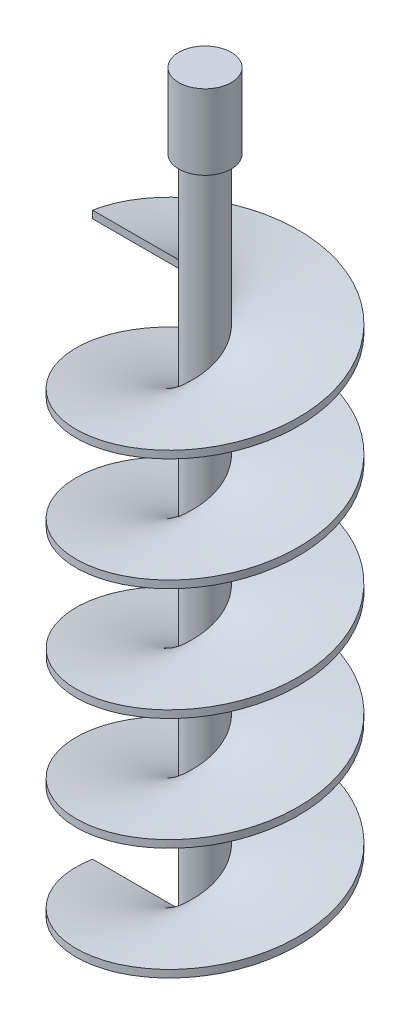
from build123d import *
from build123d.topology import SkipClean

# Parameters (mm, degrees)
SKETCH1_R           = 5
BOSS_EXTRUDE1_DEPTH = 200
SWEEP1_PITCH        = 30
SWEEP1_HEIGHT       = 150
SWEEP1_RADIUS       = 5
SWEEP1_START_ANGLE  = -90
SKETCH5_R           = 7
BOSS_EXTRUDE2_DEPTH = 20


with BuildPart() as part:
    # Sketch1 → Boss-Extrude1 (new body)
    with BuildSketch(Plane(origin=(0, 0, 0), x_dir=(1, 0, 0), z_dir=(0, 1, 0))):
        with Locations(Location((0, 0, 0), (0, 0, 270))):
            Circle(SKETCH1_R)
    extrude(amount=BOSS_EXTRUDE1_DEPTH)

    # Sweep1: sweep along a helix
    with SkipClean():  # the faces are left unmerged after this step: merging them gives an invalid solid
        with BuildLine() as sweep1_path:
            add(Helix(SWEEP1_PITCH, SWEEP1_HEIGHT, SWEEP1_RADIUS, center=(0, 0, 0), direction=(0, 1, 0), mode=Mode.PRIVATE).rotate(Axis((0, 0, 0), (0, 1, 0)), SWEEP1_START_ANGLE))
        # Sketch4 → Sweep1 (sweep)
        with BuildSketch(Plane.XY):
            Polygon((-5, 0), (-30, 0), (-30, 2), (-4.56775854, 2), (-4.56775854, 0), align=None)
        sweep(path=sweep1_path.line, is_frenet=True)

    # Sketch5 → Boss-Extrude2 (add)
    with SkipClean():  # the faces are left unmerged after this step: merging them gives an invalid solid
        with BuildSketch(Plane(origin=(0, 200, 0), x_dir=(1, 0, 0), z_dir=(0, 1, 0))):
            with Locations(Location((0, 0, 0), (0, 0, 270))):
                Circle(SKETCH5_R)
        extrude(amount=-BOSS_EXTRUDE2_DEPTH)


solid = part.part
